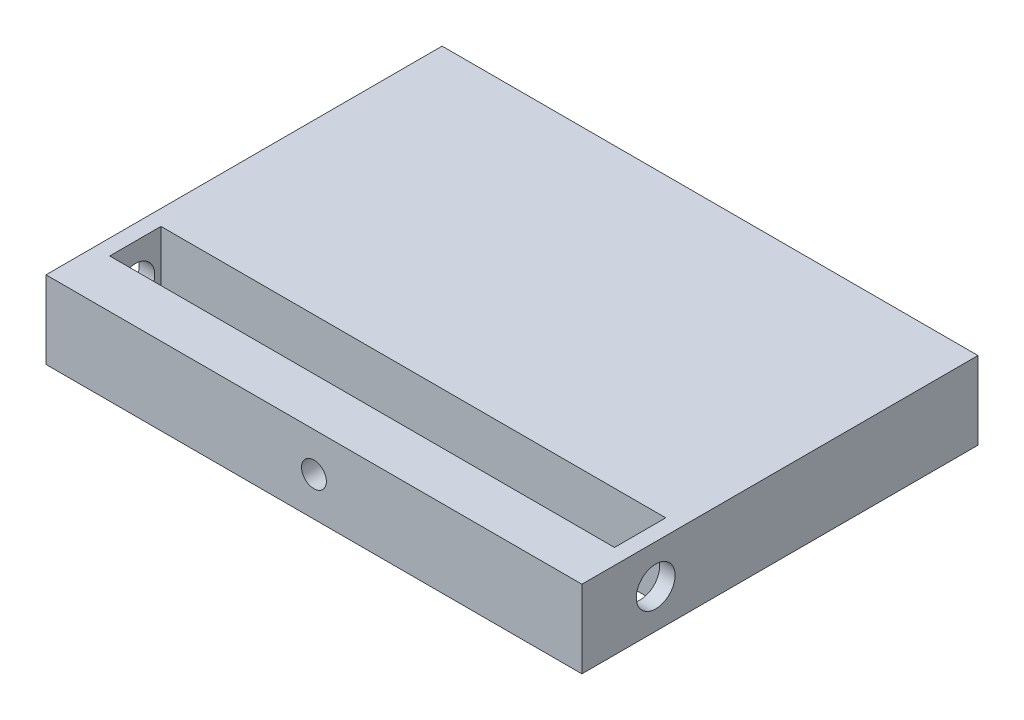
from build123d import *

# Parameters (mm, degrees)
SKETCH_1_W          = 34.5
SKETCH_1_H          = 25.5
EXTRUDE_1_DEPTH     = 5
SKETCH_5_W          = 32.5
SKETCH_5_H          = 3.3
CUT_EXTRUDE_1_DEPTH = 23.025553342
SKETCH_7_R          = 1.25
CUT_EXTRUDE_2_DEPTH = 38.118896805


with BuildPart() as part:
    # 草图1 → 凸台-拉伸1 (new body)
    with BuildSketch(Plane(origin=(0, 0, 0), x_dir=(1, 0, 0), z_dir=(0, 1, 0))):
        Rectangle(SKETCH_1_W, SKETCH_1_H)
    extrude(amount=EXTRUDE_1_DEPTH)

    # 草图5 → 切除-拉伸1 (cut, through all)
    with BuildSketch(Plane.XZ):
        with Locations((0, 8)):
            Rectangle(SKETCH_5_W, SKETCH_5_H)
    extrude(amount=-CUT_EXTRUDE_1_DEPTH, mode=Mode.SUBTRACT)

    # 草图7 → 切除-拉伸2 (cut, through all)
    with BuildSketch(Plane(origin=(17.25, 0, 0), x_dir=(0, 0, -1), z_dir=(1, 0, 0))):
        with Locations((-8, 2.5)):
            Circle(SKETCH_7_R)
    extrude(amount=-CUT_EXTRUDE_2_DEPTH, mode=Mode.SUBTRACT)

    # 草图8 → M2x0.4 螺纹孔1 (revolve, cut)
    with BuildSketch(Plane(origin=(0, 2.5, -12.75), x_dir=(0, 1, 0), z_dir=(1, 0, 0))):
        Polygon((0, 0), (0, 5.680688495), (0.8, 5.2), (0.8, 0), align=None)
    m2x0_4_1 = revolve(axis=Axis((0, 2.5, -19.1), (0, 0, 1)), mode=Mode.SUBTRACT)

    # 镜向1: M2x0.4 螺纹孔1 across plane
    add(m2x0_4_1.mirror(Plane.XY), mode=Mode.SUBTRACT)


solid = part.part
